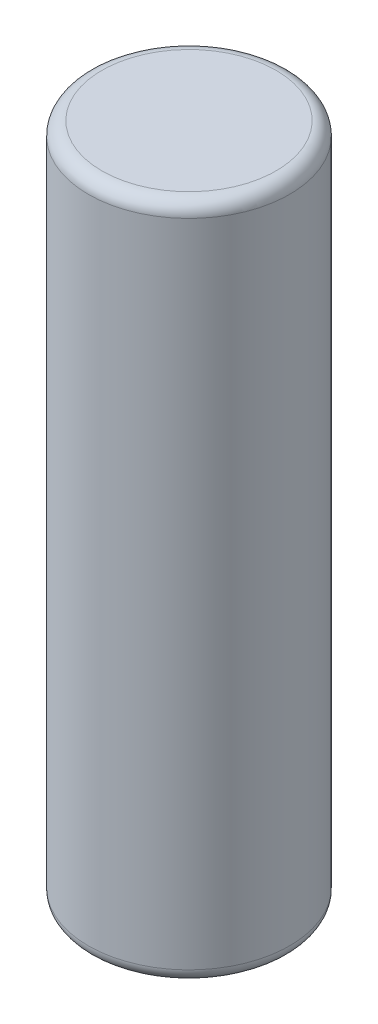
from build123d import *

# Parameters (mm, degrees)
CROQUIS1_R              = 7.425
SALIENTE_EXTRUIR1_DEPTH = 50
REDONDEO1_R             = 1


with BuildPart() as part:
    # Croquis1 → Saliente-Extruir1 (new body)
    with BuildSketch(Plane(origin=(0, 0, 0), x_dir=(1, 0, 0), z_dir=(0, 1, 0))):
        with Locations(Location((0, 0, 0), (0, 0, 270))):
            Circle(CROQUIS1_R)
    extrude(amount=SALIENTE_EXTRUIR1_DEPTH)

    # Redondeo1
    redondeo1_edges = [part.edges().sort_by_distance(p)[0] for p in [
        (0, 0, -7.425),
        (0, 50, -7.425),
    ]]
    fillet(redondeo1_edges, radius=REDONDEO1_R)


solid = part.part
